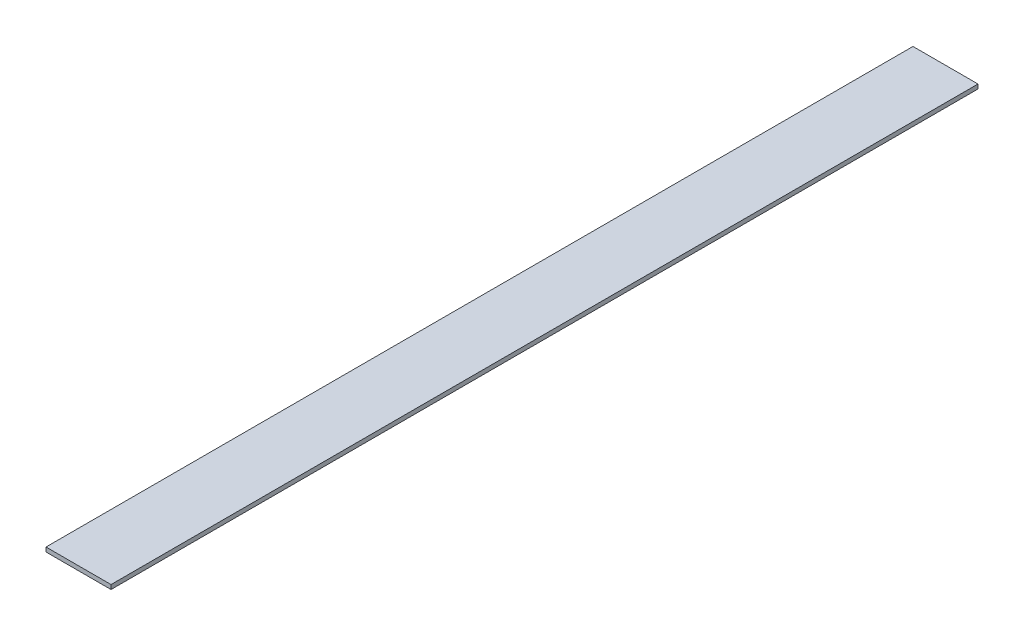
from build123d import *

# Parameters (mm, degrees)
SKETCH1_W           = 15
SKETCH1_H           = 200
BOSS_EXTRUDE1_DEPTH = 1


with BuildPart() as part:
    # Sketch1 → Boss-Extrude1 (new body)
    with BuildSketch(Plane(origin=(0, 0, 0), x_dir=(1, 0, 0), z_dir=(0, 1, 0))):
        with Locations((7.5, 100)):
            Rectangle(SKETCH1_W, SKETCH1_H)
    extrude(amount=BOSS_EXTRUDE1_DEPTH)


solid = part.part
